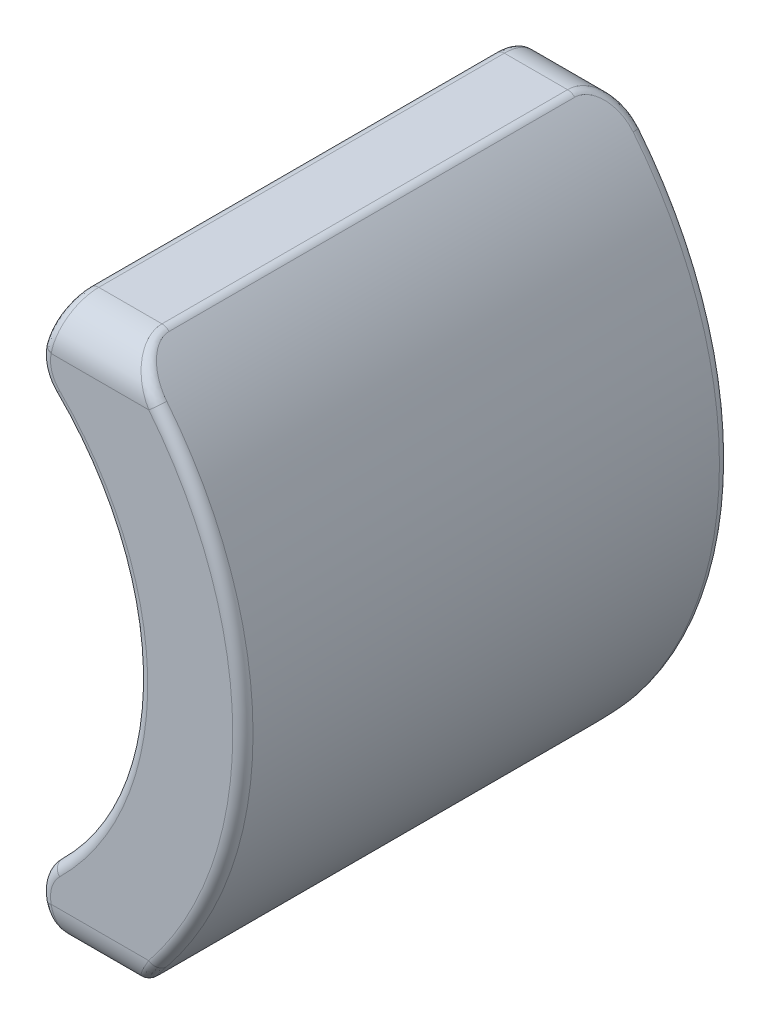
from build123d import *

# Parameters (mm, degrees)
BOSS_EXTRUDE1_DEPTH = 12
FILLET1_R           = 1
FILLET2_R           = 1
FILLET3_R           = 0.25


with BuildPart() as part:
    # Sketch1 → Boss-Extrude1 (new body)
    with BuildSketch(Plane.XY):
        with BuildLine():
            Line((6.738137725, -6.88), (4.878137725, -6.88))
            Line((4.878137725, -6.88), (4.531835438, -5.38))
            ThreePointArc((4.531835438, -5.38), (7.034339517, 0), (4.531835438, 5.38))
            Line((4.531835438, 5.38), (4.878137725, 6.88))
            Line((4.878137725, 6.88), (6.738137725, 6.88))
            ThreePointArc((6.738137725, 6.88), (9.63, 0), (6.738137725, -6.88))
        make_face()
    extrude(amount=BOSS_EXTRUDE1_DEPTH)

    # Fillet1
    fillet1_edges = [part.edges().sort_by_distance(p)[0] for p in [
        (4.531835438, -5.38, 6),
        (4.531835438, 5.38, 6),
    ]]
    fillet(fillet1_edges, radius=FILLET1_R)

    # Fillet2
    fillet2_edges = [part.edges().sort_by_distance(p)[0] for p in [
        (5.808137725, -6.88, 12),
        (5.808137725, -6.88, 0),
        (5.808137725, 6.88, 0),
        (5.808137725, 6.88, 12),
    ]]
    fillet(fillet2_edges, radius=FILLET2_R)

    # Fillet3
    fillet3_edges = [part.edges().sort_by_distance(p)[0] for p in [
        (7.034339517, 0, 0),
        (4.687877266, 5.411310183, 0),
        (7.034339517, 0, 12),
        (4.687877266, -5.411310183, 12),
        (9.63, 0, 12),
        (4.687877266, 5.411310183, 12),
        (9.63, 0, 0),
        (6.738137725, 6.88, 6),
        (6.738137725, -6.88, 6),
        (7.064336577, 6.544619807, 11.7471817),
        (7.064336577, 6.544619807, 0.2528183),
        (7.064336577, -6.544619807, 0.2528183),
        (7.064336589, -6.544619821, 11.747181705),
        (4.878137725, -6.88, 6),
        (4.815123489, -6.607055355, 0.313421155),
        (4.815123489, -6.607055355, 11.686578845),
        (4.687877266, -5.411310183, 0),
        (4.655934772, -5.914769545, 0.000604643),
        (4.655934772, -5.914769545, 11.999395357),
        (4.878137725, 6.88, 6),
        (4.815123489, 6.607055355, 11.686578845),
        (4.815123489, 6.607055355, 0.313421155),
        (4.655934776, 5.914769544, 11.99939535),
        (4.655934776, 5.914769544, 0.00060465),
    ]]
    fillet(fillet3_edges, radius=FILLET3_R)


solid = part.part
